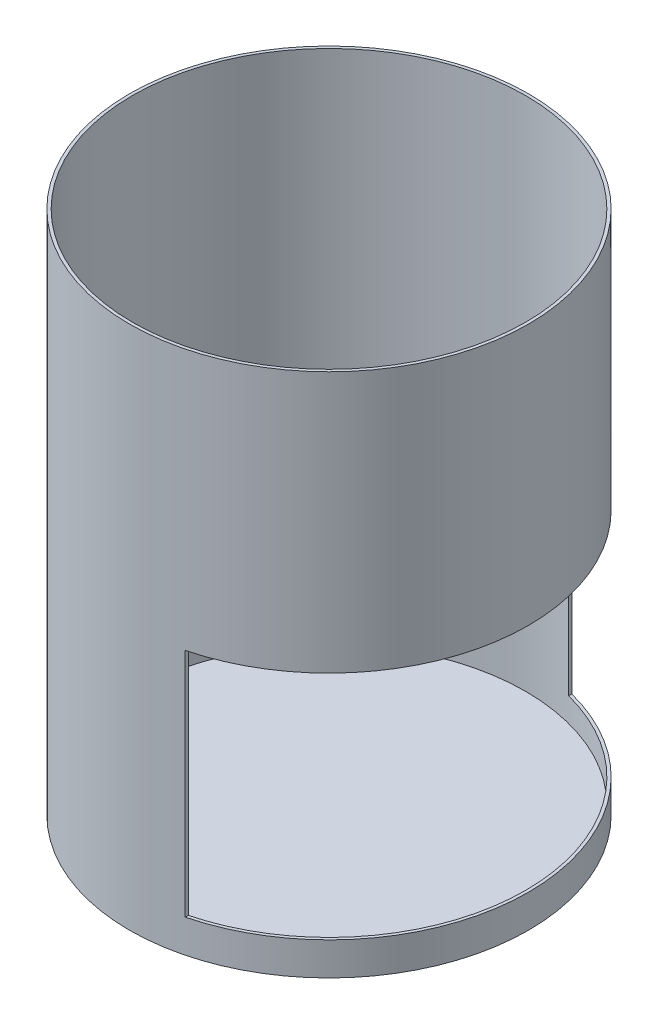
from build123d import *

# Parameters (mm, degrees)
SKETCH_2_R               = 66.5
SKETCH_2_R_2             = 65.5
EXTRUDE_1_DEPTH          = 175
SKETCH_3_R               = 65.5
EXTRUDE_2_DEPTH          = 3
CUT_EXTRUDE_1_DEPTH      = 199.669323248
CUT_EXTRUDE_1_DEPTH_BACK = 199.669323248
SKETCH_4_W               = 50
SKETCH_4_H               = 77


with BuildPart() as part:
    # 스케치2 → 보스-돌출1 (new body)
    with BuildSketch(Plane(origin=(0, 0, 0), x_dir=(1, 0, 0), z_dir=(0, 1, 0))):
        with Locations(Location((0, 0, 0), (0, 0, 270))):
            Circle(SKETCH_2_R)
        with Locations(Location((0, 0, 0), (0, 0, 270))):
            Circle(SKETCH_2_R_2, mode=Mode.SUBTRACT)
    extrude(amount=EXTRUDE_1_DEPTH)

    # 스케치3 → 보스-돌출2 (add)
    with BuildSketch(Plane(origin=(0, 0, 0), x_dir=(1, 0, 0), z_dir=(0, 1, 0))):
        with Locations(Location((0, 0, 0), (0, 0, 270))):
            Circle(SKETCH_3_R)
    extrude(amount=EXTRUDE_2_DEPTH)

    # 스케치4 → 컷-돌출1 (cut, two sides: drawn at the far end of the back side and taken through both)
    with BuildSketch(Plane.XY.offset(-CUT_EXTRUDE_1_DEPTH_BACK)):
        with Locations((41.5, 49.5)):
            Rectangle(SKETCH_4_W, SKETCH_4_H)
    extrude(amount=CUT_EXTRUDE_1_DEPTH + CUT_EXTRUDE_1_DEPTH_BACK, mode=Mode.SUBTRACT)


solid = part.part
